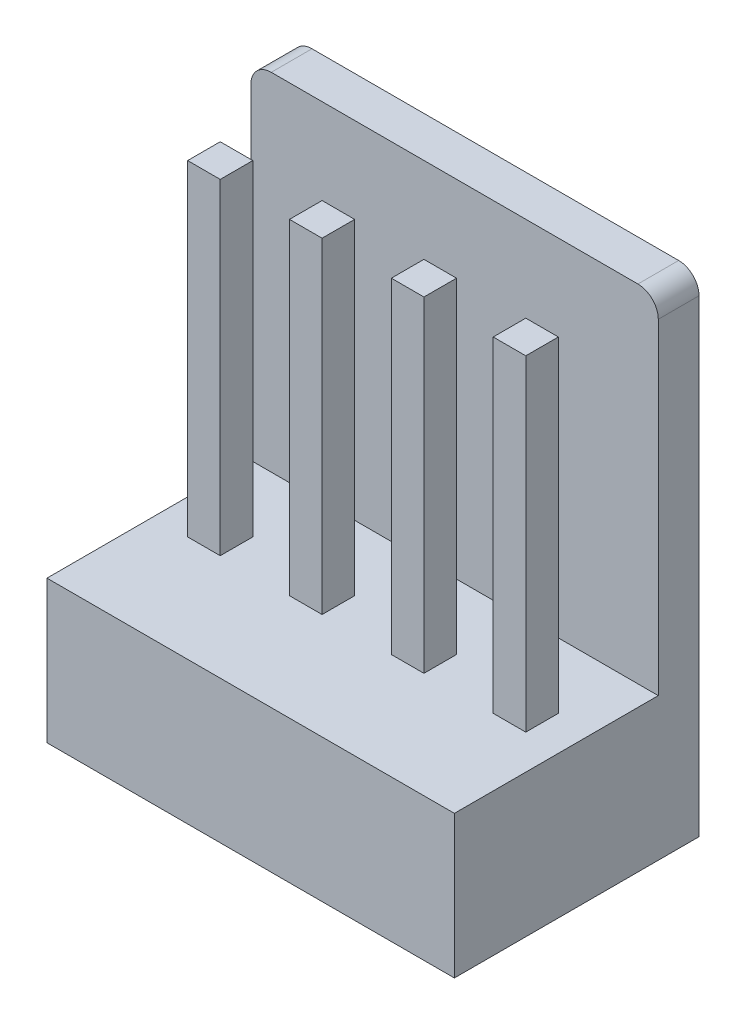
from build123d import *

# Parameters (mm, degrees)
ESBO_O1_W                = 10
ESBO_O1_H                = 6.00490196
RESSALTO_EXTRUS_O1_DEPTH = 3.5
ESBO_O2_W                = 10
ESBO_O2_H                = 1
RESSALTO_EXTRUS_O2_DEPTH = 8.5
ESBO_O3_W                = 0.8
ESBO_O3_H                = 0.8
RESSALTO_EXTRUS_O3_DEPTH = 8
FILETE1_R                = 0.5


with BuildPart() as part:
    # Esboço1 → Ressalto-extrusão1 (new body)
    with BuildSketch(Plane(origin=(0, 0, 0), x_dir=(1, 0, 0), z_dir=(0, 1, 0))):
        Rectangle(ESBO_O1_W, ESBO_O1_H)
    extrude(amount=RESSALTO_EXTRUS_O1_DEPTH)

    # Esboço2 → Ressalto-extrusão2 (add)
    with BuildSketch(Plane(origin=(0, 3.5, 0), x_dir=(1, 0, 0), z_dir=(0, 1, 0))):
        with Locations((0, 2.50245098)):
            Rectangle(ESBO_O2_W, ESBO_O2_H)
    extrude(amount=RESSALTO_EXTRUS_O2_DEPTH)

    # Esboço3 → Ressalto-extrusão3 (add)
    with BuildSketch(Plane(origin=(0, 3.5, 0), x_dir=(1, 0, 0), z_dir=(0, 1, 0))):
        with Locations((-3.75, 0)):
            Rectangle(ESBO_O3_W, ESBO_O3_H)
        with Locations((-1.25, 0)):
            Rectangle(ESBO_O3_W, ESBO_O3_H)
        with Locations((1.25, 0)):
            Rectangle(ESBO_O3_W, ESBO_O3_H)
        with Locations((3.75, 0)):
            Rectangle(ESBO_O3_W, ESBO_O3_H)
    extrude(amount=RESSALTO_EXTRUS_O3_DEPTH)

    # Filete1
    filete1_edges = [part.edges().sort_by_distance(p)[0] for p in [
        (-5, 12, -2.50245098),
        (5, 12, -2.50245098),
    ]]
    fillet(filete1_edges, radius=FILETE1_R)


solid = part.part
